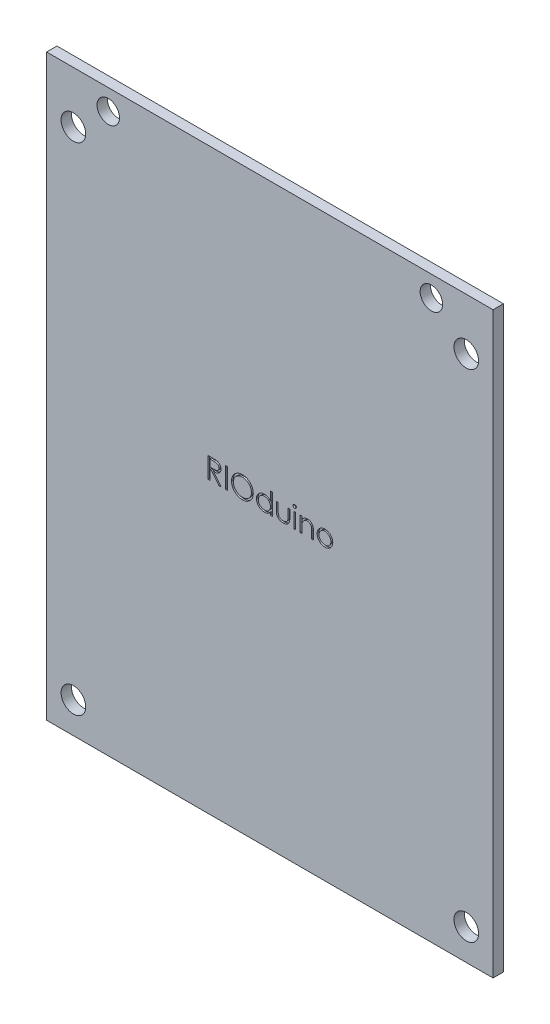
from build123d import *

# Parameters (mm, degrees)
SKETCH1_W           = 68.58
SKETCH1_H           = 88.9
BOSS_EXTRUDE1_DEPTH = 1.5875
SKETCH2_R           = 1.7272
SKETCH2_R_2         = 1.8923
CUT_EXTRUDE1_DEPTH  = 57.161612835
SKETCH3_W           = 0.284935897
SKETCH3_H           = 3.175
SKETCH3_H_2         = 2.320192308
CUT_EXTRUDE2_DEPTH  = 0.254


with BuildPart() as part:
    # Sketch1 → Boss-Extrude1 (new body)
    with BuildSketch(Plane.XY):
        Rectangle(SKETCH1_W, SKETCH1_H)
    extrude(amount=BOSS_EXTRUDE1_DEPTH)

    # Sketch2 → Cut-Extrude1 (cut, through all)
    with BuildSketch(Plane.XY.offset(1.5875)):
        with Locations((-24.8158, 41.275)):
            Circle(SKETCH2_R)
        with Locations((-30.1752, 36.5252)):
            Circle(SKETCH2_R_2)
        with Locations((-30.1752, -39.6748)):
            Circle(SKETCH2_R_2)
        with Locations(Location((30.1752, -39.6748, 0), (0, 0, 180))):
            Circle(SKETCH2_R_2)
        with Locations(Location((24.8158, 41.275, 0), (0, 0, 180))):
            Circle(SKETCH2_R)
        with Locations(Location((30.1752, 36.5252, 0), (0, 0, 180))):
            Circle(SKETCH2_R_2)
    extrude(amount=-CUT_EXTRUDE1_DEPTH, mode=Mode.SUBTRACT)

    # Sketch3 → Cut-Extrude2 (cut)
    # profile 1 of 9: a face of its own
    with BuildSketch(Plane.XY.offset(1.5875)):
        with BuildLine():
            Line((-9.504647436, 3.175), (-8.869265825, 3.175))
            add(Edge.make_bspline(
                [(-8.869265825, 3.175), (-8.826864944, 3.174858861), (-8.745450556, 3.174587859), (-8.628816232, 3.173076774), (-8.522837366, 3.168745752), (-8.427569369, 3.16501868), (-8.343013989, 3.158222418), (-8.268911947, 3.151726689), (-8.205604535, 3.143223439), (-8.167281513, 3.135326377), (-8.149929888, 3.131750801)],
                knots=[0, 0, 0, 0, 1.410062039, 2.707475311, 3.878576406, 4.937260626, 5.877586885, 6.699081471, 7.410979367, 8, 8, 8, 8], degree=3))
            add(Edge.make_bspline(
                [(-8.149929888, 3.131750801), (-8.126701022, 3.126011521), (-8.080738824, 3.114655396), (-8.014562693, 3.090652758), (-7.95150327, 3.062876384), (-7.891822501, 3.030252152), (-7.835819319, 2.992537888), (-7.78291628, 2.950384662), (-7.732873324, 2.904023126), (-7.687714274, 2.852284377), (-7.645133848, 2.798004114), (-7.609221308, 2.739308563), (-7.578263716, 2.677929892), (-7.553616176, 2.613243877), (-7.533769728, 2.545877841), (-7.519775925, 2.475221576), (-7.511383777, 2.401596977), (-7.510529379, 2.351379445), (-7.510096154, 2.325916466)],
                knots=[0, 0, 0, 0, 1.027469482, 2.033020251, 3.019912614, 3.986113645, 4.951240523, 5.91722682, 6.890402269, 7.87763091, 8.8651537, 9.85103654, 10.82876324, 11.815024772, 12.821070561, 13.842952187, 14.906261191, 16, 16, 16, 16], degree=3))
            add(Edge.make_bspline(
                [(-7.510096154, 2.325916466), (-7.511428745, 2.283611764), (-7.514028975, 2.201064333), (-7.538272462, 2.081266248), (-7.57798402, 1.969515941), (-7.63270586, 1.86595412), (-7.702392099, 1.772599463), (-7.786143874, 1.690602407), (-7.884007907, 1.621986201), (-7.975111644, 1.574404013), (-8.055588096, 1.543930446), (-8.121839744, 1.522488892), (-8.194109074, 1.505922681), (-8.271703656, 1.491081704), (-8.354946401, 1.479876953), (-8.443637793, 1.471670399), (-8.537841088, 1.466541369), (-8.602555815, 1.465777551), (-8.635847356, 1.465384615)],
                knots=[0, 0, 0, 0, 1.260483769, 2.459530307, 3.627416485, 4.787058657, 5.939039949, 7.08810263, 8.267026773, 9.491475466, 10.141966685, 10.831826277, 11.566392101, 12.351337768, 13.187381173, 14.07005841, 15.007169909, 16, 16, 16, 16], degree=3))
            Line((-8.635847356, 1.465384615), (-7.469391026, 0))
            Line((-7.469391026, 0), (-7.821744792, 0))
            Line((-7.821744792, 0), (-8.988201122, 1.465384615))
            Line((-8.988201122, 1.465384615), (-9.219711538, 1.465384615))
            Line((-9.219711538, 1.465384615), (-9.219711538, 0))
            Line((-9.219711538, 0), (-9.504647436, 0))
            Line((-9.504647436, 0), (-9.504647436, 3.175))
        make_face()
        with BuildLine():
            Line((-9.219711538, 2.849358974), (-9.219711538, 1.791025641))
            Line((-9.219711538, 1.791025641), (-8.638391426, 1.786573518))
            add(Edge.make_bspline(
                [(-8.638391426, 1.786573518), (-8.611249677, 1.78656151), (-8.558641236, 1.786538236), (-8.482531347, 1.790161162), (-8.411665245, 1.7942826), (-8.346313992, 1.80058665), (-8.286448391, 1.808711086), (-8.232098366, 1.818873793), (-8.183175198, 1.830713879), (-8.126117238, 1.849039639), (-8.06240267, 1.87807367), (-7.993159132, 1.920315229), (-7.934192725, 1.973445788), (-7.884374379, 2.03420028), (-7.84434268, 2.100998877), (-7.816119602, 2.173040869), (-7.798210387, 2.248507533), (-7.796098064, 2.300376245), (-7.795032051, 2.326552484)],
                knots=[0, 0, 0, 0, 1.146690395, 2.22261258, 3.21895312, 4.145990853, 4.996080663, 5.770904154, 6.481378293, 7.121626537, 8.300444488, 9.431385265, 10.535395872, 11.636531494, 12.74115979, 13.810798291, 14.895190096, 16, 16, 16, 16], degree=3))
            add(Edge.make_bspline(
                [(-7.795032051, 2.326552484), (-7.796122547, 2.352085447), (-7.798283511, 2.402682464), (-7.815926323, 2.47675604), (-7.84576169, 2.546666773), (-7.885968291, 2.61213027), (-7.934953239, 2.67155333), (-7.992391541, 2.722396105), (-8.056712682, 2.764350976), (-8.116830126, 2.791161022), (-8.170564019, 2.807598317), (-8.217218068, 2.819165444), (-8.26993348, 2.828458641), (-8.328966217, 2.835904525), (-8.394064268, 2.842304367), (-8.465556787, 2.846614909), (-8.542969438, 2.849167486), (-8.596624154, 2.849293659), (-8.624399038, 2.849358974)],
                knots=[0, 0, 0, 0, 1.101028733, 2.181837193, 3.264309656, 4.369019818, 5.486613113, 6.575447106, 7.666700264, 8.788928104, 9.402425223, 10.0903467, 10.862060571, 11.710948788, 12.657782767, 13.684531032, 14.801375019, 16, 16, 16, 16], degree=3))
            Line((-8.624399038, 2.849358974), (-9.219711538, 2.849358974))
        make_face(mode=Mode.SUBTRACT)
    # profile 2 of 9: a face of its own
    with BuildSketch(Plane.XY.offset(1.5875)):
        with Locations((-6.675641026, 1.5875)):
            Rectangle(SKETCH3_W, SKETCH3_H)
    # profile 3 of 9: a face of its own
    with BuildSketch(Plane.XY.offset(1.5875)):
        with BuildLine():
            add(Edge.make_bspline(
                [(-4.233333333, 3.256410256), (-4.174543123, 3.2549212), (-4.059074299, 3.251996571), (-3.889370642, 3.229609098), (-3.727359377, 3.19087828), (-3.571720751, 3.139295432), (-3.424316408, 3.070484668), (-3.284036841, 2.98731314), (-3.15121582, 2.888909496), (-3.027643567, 2.776034411), (-2.914561905, 2.653222278), (-2.814934137, 2.522160174), (-2.731438627, 2.383640546), (-2.66287152, 2.23807965), (-2.60907921, 2.085806679), (-2.571959792, 1.926009834), (-2.548248756, 1.759724479), (-2.545476729, 1.646307252), (-2.544070513, 1.588772035)],
                knots=[0, 0, 0, 0, 1.065120563, 2.091984664, 3.0946048, 4.079830382, 5.057816894, 6.036188127, 7.030412546, 8.04752943, 9.064399622, 10.05169764, 11.02544977, 11.989514704, 12.962713494, 13.945757189, 14.957906945, 16, 16, 16, 16], degree=3))
            add(Edge.make_bspline(
                [(-2.544070513, 1.588772035), (-2.545476523, 1.531660637), (-2.548247932, 1.419087456), (-2.571986752, 1.253857332), (-2.609216802, 1.095025057), (-2.662371986, 0.942855786), (-2.730612241, 0.797188996), (-2.814663718, 0.658407974), (-2.913670388, 0.526467222), (-3.026343746, 0.402812161), (-3.149171834, 0.289421599), (-3.280916433, 0.190616618), (-3.418614659, 0.105595448), (-3.564038465, 0.037755973), (-3.715259213, -0.016465698), (-3.873630321, -0.053434155), (-4.038409695, -0.077280259), (-4.150778391, -0.080018484), (-4.207892628, -0.081410256)],
                knots=[0, 0, 0, 0, 1.043624062, 2.057103931, 3.04512605, 4.022047818, 4.998200453, 5.980619268, 6.982898556, 8.009068085, 9.034988726, 10.034168286, 11.015286542, 11.987931943, 12.962482838, 13.94673481, 14.956375938, 16, 16, 16, 16], degree=3))
            add(Edge.make_bspline(
                [(-4.207892628, -0.081410256), (-4.265427546, -0.080004741), (-4.378844185, -0.077234097), (-4.545338496, -0.053483822), (-4.705247592, -0.016344211), (-4.858114182, 0.036732206), (-5.004023511, 0.105327837), (-5.143260943, 0.188970381), (-5.275267598, 0.288218287), (-5.398949039, 0.400855109), (-5.512114383, 0.523475017), (-5.610774674, 0.654860377), (-5.694436027, 0.792433541), (-5.762801336, 0.936576295), (-5.816925524, 1.086591818), (-5.853850609, 1.243480794), (-5.87774108, 1.406348774), (-5.880494119, 1.517240546), (-5.881891026, 1.573507612)],
                knots=[0, 0, 0, 0, 1.053102029, 2.075944431, 3.073151272, 4.055350789, 5.033113405, 6.020478099, 7.024410459, 8.052272461, 9.079885166, 10.07527673, 11.055994387, 12.023226415, 12.992069828, 13.970394897, 14.97016774, 16, 16, 16, 16], degree=3))
            add(Edge.make_bspline(
                [(-5.881891026, 1.573507612), (-5.881406035, 1.611274391), (-5.880442172, 1.686331503), (-5.868838279, 1.797789061), (-5.852000165, 1.907454158), (-5.82786843, 2.015014947), (-5.796307417, 2.120208126), (-5.759067364, 2.223759175), (-5.713583361, 2.324618696), (-5.662165916, 2.423264487), (-5.604778419, 2.518158801), (-5.541391132, 2.607856709), (-5.474230476, 2.693110899), (-5.400603684, 2.771712109), (-5.322937337, 2.845946926), (-5.239971522, 2.914674534), (-5.152212487, 2.978514668), (-5.059282613, 3.036045977), (-4.96347175, 3.088078906), (-4.864704959, 3.132730157), (-4.76432364, 3.17105337), (-4.661857638, 3.20211469), (-4.557579052, 3.226636608), (-4.45126029, 3.243334708), (-4.342986054, 3.254968196), (-4.2700415, 3.255927501), (-4.233333333, 3.256410256)],
                knots=[0, 0, 0, 0, 1.037015668, 2.060948919, 3.074880161, 4.083647147, 5.086022904, 6.090072063, 7.104153813, 8.122640571, 9.144368836, 10.147691507, 11.138137339, 12.123020368, 13.103399296, 14.087645067, 15.080126199, 16.082011238, 17.087798457, 18.072939717, 19.057185487, 20.037253025, 21.01195951, 21.997135196, 22.992090687, 24, 24, 24, 24], degree=3))
        make_face()
        with BuildLine():
            add(Edge.make_bspline(
                [(-4.219340946, 2.930769231), (-4.249471363, 2.930401937), (-4.309444149, 2.929670862), (-4.398602264, 2.920040892), (-4.486587804, 2.906315921), (-4.57341894, 2.886738399), (-4.65873236, 2.860064722), (-4.743323287, 2.829366184), (-4.826420343, 2.791972766), (-4.9077492, 2.74972467), (-4.986593589, 2.702962435), (-5.060990826, 2.651280903), (-5.13113351, 2.595892072), (-5.196849902, 2.536666676), (-5.257947037, 2.473303109), (-5.315627444, 2.406761971), (-5.367579136, 2.335141327), (-5.415191052, 2.260383315), (-5.457797593, 2.182585309), (-5.495684736, 2.102566362), (-5.526676373, 2.019673747), (-5.551951529, 1.934806761), (-5.572906357, 1.848099815), (-5.586181417, 1.758895152), (-5.5959172, 1.667641015), (-5.596606488, 1.605971762), (-5.596955128, 1.574779647)],
                knots=[0, 0, 0, 0, 1.008559885, 2.007477868, 2.99961109, 3.989939068, 4.984837346, 5.991145699, 7.001802488, 8.033829008, 9.059044045, 10.069351652, 11.065060232, 12.050310815, 13.029377138, 14.011219647, 14.996725999, 15.989392538, 16.977580475, 17.965360261, 18.951710183, 19.937753436, 20.929683414, 21.935841486, 22.955955122, 24, 24, 24, 24], degree=3))
            add(Edge.make_bspline(
                [(-5.596955128, 1.574779647), (-5.595798646, 1.52891249), (-5.593523489, 1.438677602), (-5.573604836, 1.306445071), (-5.542923473, 1.179364983), (-5.497695719, 1.05813268), (-5.441134805, 0.94170608), (-5.371260411, 0.831118014), (-5.288475384, 0.726338592), (-5.194437756, 0.628099312), (-5.091637872, 0.538432047), (-4.982478896, 0.459725241), (-4.868130266, 0.393131657), (-4.748293789, 0.338879913), (-4.623609236, 0.29589065), (-4.493273172, 0.266427892), (-4.358153826, 0.247037301), (-4.266051018, 0.245175158), (-4.219340946, 0.244230769)],
                knots=[0, 0, 0, 0, 1.032063989, 2.030389145, 3.003944642, 3.970395727, 4.937377036, 5.913328081, 6.909231446, 7.93887556, 8.970685674, 9.976071282, 10.964166581, 11.944589148, 12.933237628, 13.927779006, 14.949070134, 16, 16, 16, 16], degree=3))
            add(Edge.make_bspline(
                [(-4.219340946, 0.244230769), (-4.187945183, 0.24466212), (-4.125677957, 0.245517617), (-4.033062734, 0.254134274), (-3.942116027, 0.267951755), (-3.852965402, 0.287845993), (-3.765712037, 0.31274453), (-3.679991752, 0.342324398), (-3.596717588, 0.379228061), (-3.514839021, 0.420002274), (-3.436465288, 0.466484417), (-3.361648198, 0.516411882), (-3.292273559, 0.57171913), (-3.22660633, 0.630064575), (-3.165258355, 0.692624637), (-3.10864449, 0.759317981), (-3.056955371, 0.830565577), (-3.009361534, 0.905210195), (-2.966904288, 0.983221081), (-2.92991182, 1.063530146), (-2.898528201, 1.145939638), (-2.873193057, 1.230568421), (-2.853339817, 1.317255762), (-2.839660175, 1.406117733), (-2.830091234, 1.496976565), (-2.829369986, 1.558429921), (-2.82900641, 1.589408053)],
                knots=[0, 0, 0, 0, 1.047197238, 2.076906641, 3.100256066, 4.114471768, 5.12198147, 6.126382909, 7.136867548, 8.15857795, 9.17633901, 10.174870724, 11.156907918, 12.133735059, 13.104061851, 14.077631395, 15.04955518, 16.038496417, 17.029181396, 18.010275684, 18.986308667, 19.968651475, 20.955262928, 21.950658345, 22.966943676, 24, 24, 24, 24], degree=3))
            add(Edge.make_bspline(
                [(-2.82900641, 1.589408053), (-2.829370277, 1.62017426), (-2.830092074, 1.6812047), (-2.839655604, 1.771429871), (-2.853354269, 1.859652427), (-2.873096154, 1.94552602), (-2.898541651, 2.029072539), (-2.929917301, 2.110213517), (-2.966915394, 2.189251237), (-3.00937714, 2.265990349), (-3.057107209, 2.339627433), (-3.109262701, 2.410023907), (-3.166744124, 2.475857751), (-3.227909161, 2.538754224), (-3.294285607, 2.597371881), (-3.365572788, 2.651730167), (-3.440905267, 2.703140923), (-3.52066783, 2.749519112), (-3.60298556, 2.792349166), (-3.687453222, 2.829044004), (-3.773113905, 2.860224427), (-3.859749778, 2.886819102), (-3.948090051, 2.906239244), (-4.03753781, 2.92005326), (-4.127969302, 2.92966751), (-4.18878708, 2.930400825), (-4.219340946, 2.930769231)],
                knots=[0, 0, 0, 0, 1.02996197, 2.043119294, 3.035359645, 4.018872909, 4.991431989, 5.957985074, 6.929999688, 7.912076566, 8.892894881, 9.867085534, 10.843653904, 11.817741046, 12.803660682, 13.806313499, 14.818574707, 15.856120519, 16.894564902, 17.924820532, 18.937903209, 19.946497019, 20.957711757, 21.963978472, 22.977135795, 24, 24, 24, 24], degree=3))
        make_face(mode=Mode.SUBTRACT)
    # profile 4 of 9: a face of its own
    with BuildSketch(Plane.XY.offset(1.5875)):
        with BuildLine():
            Line((0.386698718, 3.256410256), (0.386698718, 0))
            Line((0.386698718, 0), (0.101762821, 0))
            Line((0.101762821, 0), (0.101762821, 0.401327123))
            add(Edge.make_bspline(
                [(0.101762821, 0.401327123), (0.069632918, 0.365005492), (0.006931008, 0.294123371), (-0.097790578, 0.201520257), (-0.208795996, 0.124977066), (-0.32554648, 0.063155356), (-0.447936601, 0.016716848), (-0.575695052, -0.016290596), (-0.708873947, -0.037512147), (-0.799817155, -0.039631252), (-0.845903446, -0.040705128)],
                knots=[0, 0, 0, 0, 1.074387032, 2.096679803, 3.090159297, 4.057316773, 5.018401886, 5.985159533, 6.978961417, 8, 8, 8, 8], degree=3))
            add(Edge.make_bspline(
                [(-0.845903446, -0.040705128), (-0.886877232, -0.039592633), (-0.967679354, -0.037398744), (-1.086541445, -0.020378655), (-1.200925129, 0.006954124), (-1.310938491, 0.044964216), (-1.415869651, 0.095383962), (-1.516617025, 0.155746379), (-1.612658681, 0.227629132), (-1.70253072, 0.309805415), (-1.785291178, 0.399063725), (-1.857918189, 0.494264328), (-1.918472769, 0.594995561), (-1.969109556, 0.699982065), (-2.008113383, 0.810032028), (-2.035303751, 0.924764887), (-2.052304014, 1.044044987), (-2.054496996, 1.125270126), (-2.055608974, 1.16645633)],
                knots=[0, 0, 0, 0, 1.033919861, 2.038935746, 3.024066025, 3.998881131, 4.97069526, 5.957263378, 6.95902576, 7.993208707, 9.027059324, 10.027763471, 11.009749337, 11.988697705, 12.965288445, 13.950418724, 14.960734635, 16, 16, 16, 16], degree=3))
            add(Edge.make_bspline(
                [(-2.055608974, 1.16645633), (-2.05447235, 1.206791261), (-2.052225306, 1.286531244), (-2.035485599, 1.403805492), (-2.007336041, 1.516761342), (-1.967831923, 1.625035141), (-1.917175292, 1.728757901), (-1.855554813, 1.82800298), (-1.782966036, 1.923043791), (-1.699279924, 2.011645547), (-1.608624811, 2.093488533), (-1.511643319, 2.164616738), (-1.410747914, 2.226045594), (-1.304373611, 2.274716962), (-1.194094881, 2.314095221), (-1.078929969, 2.341339413), (-0.959358037, 2.357393412), (-0.878177376, 2.359718205), (-0.836999199, 2.360897436)],
                knots=[0, 0, 0, 0, 1.020392517, 2.01726096, 2.990465484, 3.961182959, 4.928053699, 5.906110375, 6.912531644, 7.948652711, 8.985773172, 9.998621852, 10.987621588, 11.969261332, 12.953316658, 13.946091881, 14.958173133, 16, 16, 16, 16], degree=3))
            add(Edge.make_bspline(
                [(-0.836999199, 2.360897436), (-0.789631095, 2.359475856), (-0.69665277, 2.356685452), (-0.560673397, 2.333366105), (-0.432051779, 2.294211209), (-0.310047426, 2.240606975), (-0.195387689, 2.170937722), (-0.087232094, 2.086798909), (0.012538492, 1.985809283), (0.071567931, 1.909961642), (0.101762821, 1.871163862)],
                knots=[0, 0, 0, 0, 1.031072012, 2.023879775, 2.993683497, 3.952812103, 4.918022106, 5.908088563, 6.929940113, 8, 8, 8, 8], degree=3))
            Line((0.101762821, 1.871163862), (0.101762821, 3.256410256))
            Line((0.101762821, 3.256410256), (0.386698718, 3.256410256))
        make_face()
        with BuildLine():
            add(Edge.make_bspline(
                [(-0.833183093, 2.075961538), (-0.874833957, 2.074479596), (-0.957046137, 2.071554476), (-1.077736053, 2.04871852), (-1.193227507, 2.010723209), (-1.302942874, 1.958760342), (-1.405149042, 1.893419988), (-1.496492586, 1.814388447), (-1.577720608, 1.723822013), (-1.646035962, 1.622129384), (-1.701725913, 1.513110687), (-1.740884578, 1.399151376), (-1.766710252, 1.28230686), (-1.769348696, 1.203056424), (-1.770673077, 1.163276242)],
                knots=[0, 0, 0, 0, 1.031046209, 2.035121221, 3.029706178, 4.034933723, 5.034054252, 6.02443088, 7.017295772, 8.038157696, 9.050218397, 10.03989886, 11.016116709, 12, 12, 12, 12], degree=3))
            add(Edge.make_bspline(
                [(-1.770673077, 1.163276242), (-1.768981352, 1.123733788), (-1.765604534, 1.044803872), (-1.741337833, 0.927800063), (-1.700625376, 0.813813896), (-1.645070076, 0.703812852), (-1.575504352, 0.60168299), (-1.494869646, 0.509390164), (-1.402386177, 0.430024609), (-1.299944795, 0.363587667), (-1.190536136, 0.309918809), (-1.075479641, 0.272575693), (-0.95693817, 0.248465849), (-0.87633641, 0.245649645), (-0.835727163, 0.244230769)],
                knots=[0, 0, 0, 0, 0.979072187, 1.954306742, 2.945804271, 3.96968567, 4.997920485, 5.998718438, 6.996577872, 8.005894225, 9.015743152, 10.005417472, 10.995077863, 12, 12, 12, 12], degree=3))
            add(Edge.make_bspline(
                [(-0.835727163, 0.244230769), (-0.794500693, 0.245736594), (-0.712505332, 0.248731529), (-0.591457362, 0.271665248), (-0.473986931, 0.309555515), (-0.361694231, 0.362078295), (-0.257086026, 0.427172467), (-0.163198666, 0.5033789), (-0.08380918, 0.592009646), (-0.016505885, 0.689415428), (0.036267529, 0.796197025), (0.074708668, 0.909893041), (0.09743614, 1.030507434), (0.100300652, 1.112933996), (0.101762821, 1.155008013)],
                knots=[0, 0, 0, 0, 1.01762866, 2.023962475, 3.030623092, 4.058876274, 5.077231937, 6.066672613, 7.034107872, 8.005628644, 8.981990164, 9.965428785, 10.961468474, 12, 12, 12, 12], degree=3))
            add(Edge.make_bspline(
                [(0.101762821, 1.155008013), (0.100892275, 1.187064473), (0.099178766, 1.250161732), (0.086088178, 1.34280598), (0.065264781, 1.431464432), (0.035922184, 1.5162303), (-0.002623482, 1.596634921), (-0.049112526, 1.673255618), (-0.10436247, 1.745693888), (-0.167483916, 1.812952245), (-0.236576635, 1.874299107), (-0.309687397, 1.929058097), (-0.387682403, 1.974042198), (-0.469250001, 2.011272494), (-0.554531712, 2.040899009), (-0.644221488, 2.06066356), (-0.737365998, 2.074234708), (-0.800907777, 2.075379868), (-0.833183093, 2.075961538)],
                knots=[0, 0, 0, 0, 1.050140795, 2.067009409, 3.05949893, 4.030605086, 5.00011959, 5.97591094, 6.962425594, 7.979863591, 8.993523472, 9.986985069, 10.967611495, 11.937549037, 12.921786183, 13.919465291, 14.943216303, 16, 16, 16, 16], degree=3))
        make_face(mode=Mode.SUBTRACT)
    # profile 5 of 9: a face of its own
    with BuildSketch(Plane.XY.offset(1.5875)):
        with BuildLine():
            Line((0.997275641, 2.320192308), (1.282211538, 2.320192308))
            Line((1.282211538, 2.320192308), (1.282211538, 1.244050481))
            add(Edge.make_bspline(
                [(1.282211538, 1.244050481), (1.282340266, 1.212461273), (1.282586517, 1.152032597), (1.284256514, 1.065078249), (1.288184527, 0.985778803), (1.293095639, 0.914088448), (1.299411291, 0.850019315), (1.306925483, 0.793795184), (1.315324194, 0.74477846), (1.32354537, 0.715256987), (1.32736879, 0.701527444)],
                knots=[0, 0, 0, 0, 1.388932606, 2.656963016, 3.823490214, 4.879454478, 5.816252168, 6.653371382, 7.373723809, 8, 8, 8, 8], degree=3))
            add(Edge.make_bspline(
                [(1.32736879, 0.701527444), (1.333502396, 0.684270982), (1.345642091, 0.650116817), (1.367661608, 0.600778219), (1.394901599, 0.555080642), (1.424710157, 0.511261947), (1.459090334, 0.470620145), (1.49760714, 0.433223867), (1.538971255, 0.397660155), (1.600434741, 0.355582523), (1.684489932, 0.310483616), (1.79484636, 0.271570981), (1.914502336, 0.24831563), (1.99720176, 0.245617556), (2.039708534, 0.244230769)],
                knots=[0, 0, 0, 0, 0.725840625, 1.436591201, 2.137033971, 2.831655856, 3.53531722, 4.242432219, 4.957935707, 5.694543706, 7.190802206, 8.724350549, 10.316345118, 12, 12, 12, 12], degree=3))
            add(Edge.make_bspline(
                [(2.039708534, 0.244230769), (2.082211359, 0.245647045), (2.16444646, 0.248387276), (2.282787754, 0.270869486), (2.390965823, 0.308430361), (2.4878949, 0.360869942), (2.573135341, 0.425043099), (2.644168635, 0.500343946), (2.702776644, 0.584390176), (2.728366619, 0.647095772), (2.741235978, 0.678630809)],
                knots=[0, 0, 0, 0, 1.157059328, 2.238695713, 3.266970494, 4.264342957, 5.228770407, 6.160125903, 7.074715775, 8, 8, 8, 8], degree=3))
            add(Edge.make_bspline(
                [(2.741235978, 0.678630809), (2.745040743, 0.691300237), (2.753452151, 0.719309249), (2.762489427, 0.766825163), (2.770630546, 0.823489483), (2.777582142, 0.889673001), (2.782539825, 0.965202761), (2.785212292, 1.050055158), (2.788231513, 1.143963821), (2.788277339, 1.209702431), (2.788301282, 1.244050481)],
                knots=[0, 0, 0, 0, 0.557542046, 1.232589297, 2.036731608, 2.971723315, 4.038036528, 5.22795436, 6.551621927, 8, 8, 8, 8], degree=3))
            Line((2.788301282, 1.244050481), (2.788301282, 2.320192308))
            Line((2.788301282, 2.320192308), (3.073237179, 2.320192308))
            Line((3.073237179, 2.320192308), (3.073237179, 1.190625))
            add(Edge.make_bspline(
                [(3.073237179, 1.190625), (3.072836499, 1.152246352), (3.072059125, 1.077786524), (3.067063177, 0.969578794), (3.058491029, 0.868738758), (3.045480164, 0.775213037), (3.030180588, 0.689073036), (3.010444541, 0.610208352), (2.986878568, 0.538861971), (2.960294279, 0.473781931), (2.928887299, 0.414775105), (2.895479931, 0.3587719), (2.856903888, 0.307161881), (2.816290889, 0.257375942), (2.771113673, 0.211890413), (2.722218801, 0.169661575), (2.67029447, 0.130043896), (2.614188412, 0.094582521), (2.554719698, 0.062635993), (2.491814913, 0.03431855), (2.424703579, 0.011909784), (2.354251566, -0.007422034), (2.280113701, -0.022584446), (2.202361459, -0.033276545), (2.121021029, -0.039830953), (2.065586019, -0.040408843), (2.037164463, -0.040705128)],
                knots=[0, 0, 0, 0, 1.493040784, 2.896703357, 4.213163133, 5.428574705, 6.569057535, 7.615249723, 8.588095153, 9.490268104, 10.346124644, 11.18633936, 12.024365274, 12.850166724, 13.684164916, 14.514361689, 15.362232829, 16.222528818, 17.093394965, 17.986930858, 18.902426812, 19.842810585, 20.827885679, 21.843828298, 22.894529745, 24, 24, 24, 24], degree=3))
            add(Edge.make_bspline(
                [(2.037164463, -0.040705128), (2.008955482, -0.040396965), (1.953522209, -0.039791396), (1.872177581, -0.033312757), (1.794209916, -0.022601059), (1.719896412, -0.007310969), (1.649162495, 0.011774473), (1.581721648, 0.034456252), (1.518363559, 0.062650689), (1.458327027, 0.09438033), (1.402082003, 0.130271687), (1.349369222, 0.169612694), (1.300259363, 0.212344623), (1.254741594, 0.258289011), (1.213454822, 0.308015804), (1.175884556, 0.36112499), (1.141452402, 0.417090342), (1.110289513, 0.477019068), (1.083518135, 0.542852249), (1.059882305, 0.615693187), (1.040550512, 0.69634047), (1.024818415, 0.784725148), (1.012162466, 0.880424221), (1.003375751, 0.983991284), (0.998462819, 1.095174061), (0.997679899, 1.171963605), (0.997275641, 1.211613582)],
                knots=[0, 0, 0, 0, 1.083640291, 2.129454052, 3.13281866, 4.105697902, 5.042300162, 5.946461698, 6.836384745, 7.703652036, 8.553297018, 9.397182691, 10.228592656, 11.052265423, 11.879314572, 12.708807002, 13.549817954, 14.402308542, 15.300838682, 16.27712199, 17.341985831, 18.484375296, 19.725102775, 21.0496083, 22.476576903, 24, 24, 24, 24], degree=3))
            Line((0.997275641, 1.211613582), (0.997275641, 2.320192308))
        make_face()
    # profile 6 of 9: a face of its own
    with BuildSketch(Plane.XY.offset(1.5875)):
        with BuildLine():
            add(Edge.make_bspline(
                [(3.825010016, 3.297115385), (3.842691424, 3.296295189), (3.877315016, 3.294689089), (3.927383195, 3.280935463), (3.972973485, 3.257622177), (4.013411857, 3.226344181), (4.048111782, 3.189560043), (4.072405712, 3.146687593), (4.088019815, 3.100370114), (4.089905361, 3.06806214), (4.090865385, 3.05161258)],
                knots=[0, 0, 0, 0, 1.055194115, 2.066272739, 3.074728998, 4.095836921, 5.109056067, 6.073838105, 7.019297344, 8, 8, 8, 8], degree=3))
            add(Edge.make_bspline(
                [(4.090865385, 3.05161258), (4.089883711, 3.03559003), (4.087943059, 3.003915346), (4.072417773, 2.958400839), (4.047904743, 2.916124096), (4.013434107, 2.879411381), (3.972967589, 2.848150675), (3.927384761, 2.824832805), (3.877314604, 2.811080395), (3.842691285, 2.809474127), (3.825010016, 2.808653846)],
                knots=[0, 0, 0, 0, 0.96129708, 1.900370562, 2.859976407, 3.87933698, 4.906634145, 5.921202961, 6.938410037, 8, 8, 8, 8], degree=3))
            add(Edge.make_bspline(
                [(3.825010016, 2.808653846), (3.807530938, 2.809442807), (3.773510196, 2.810978415), (3.724191703, 2.825102646), (3.678990145, 2.848158655), (3.638472906, 2.879206694), (3.604699802, 2.916349565), (3.58011775, 2.958375039), (3.56462832, 3.003921915), (3.562682836, 3.035592237), (3.561698718, 3.05161258)],
                knots=[0, 0, 0, 0, 1.054934014, 2.053291228, 3.073705704, 4.106921865, 5.123545215, 6.088680038, 7.033164197, 8, 8, 8, 8], degree=3))
            add(Edge.make_bspline(
                [(3.561698718, 3.05161258), (3.562661275, 3.068059851), (3.564551798, 3.100363328), (3.580129361, 3.146713822), (3.604495043, 3.189332756), (3.638495269, 3.226548745), (3.678984193, 3.257614247), (3.724193241, 3.280665637), (3.77350979, 3.294791066), (3.8075308, 3.296326509), (3.825010016, 3.297115385)],
                knots=[0, 0, 0, 0, 0.98631895, 1.937192651, 2.907499808, 3.917963147, 4.944918757, 5.95915025, 6.951458133, 8, 8, 8, 8], degree=3))
        make_face()
    # profile 7 of 9: a face of its own
    with BuildSketch(Plane.XY.offset(1.5875)):
        with Locations((3.826282052, 1.160096154)):
            Rectangle(SKETCH3_W, SKETCH3_H_2)
    # profile 8 of 9: a face of its own
    with BuildSketch(Plane.XY.offset(1.5875)):
        with BuildLine():
            Line((4.660737179, 2.320192308), (4.945673077, 2.320192308))
            Line((4.945673077, 2.320192308), (4.945673077, 1.901692708))
            add(Edge.make_bspline(
                [(4.945673077, 1.901692708), (4.976096503, 1.939650035), (5.035134223, 2.013307553), (5.133454297, 2.11011836), (5.237361978, 2.189897243), (5.346220938, 2.253491399), (5.460178954, 2.301430838), (5.578541385, 2.33605279), (5.702016868, 2.356812599), (5.785986036, 2.359525165), (5.828465545, 2.360897436)],
                knots=[0, 0, 0, 0, 1.12780773, 2.188550248, 3.19190651, 4.159438251, 5.104880172, 6.052711206, 7.014878035, 8, 8, 8, 8], degree=3))
            add(Edge.make_bspline(
                [(5.828465545, 2.360897436), (5.871401192, 2.359314294), (5.955436609, 2.356215704), (6.077790279, 2.331707706), (6.192066143, 2.289847367), (6.29785674, 2.232504989), (6.393222141, 2.161197688), (6.47697397, 2.078123558), (6.546246345, 1.982568682), (6.592689667, 1.893919819), (6.623283647, 1.815280699), (6.642544411, 1.74792829), (6.658901087, 1.67289111), (6.673081315, 1.590395911), (6.682676267, 1.499864696), (6.690243917, 1.401668575), (6.695667447, 1.295839357), (6.695882627, 1.222645059), (6.69599359, 1.184900841)],
                knots=[0, 0, 0, 0, 1.235846778, 2.418850247, 3.575807741, 4.728682307, 5.871620074, 6.994088408, 8.11269785, 9.256955736, 9.865816715, 10.540099792, 11.271859618, 12.076849838, 12.949306005, 13.892391288, 14.913166135, 16, 16, 16, 16], degree=3))
            Line((6.69599359, 1.184900841), (6.69599359, 0))
            Line((6.69599359, 0), (6.411057692, 0))
            Line((6.411057692, 0), (6.411057692, 1.09140625))
            add(Edge.make_bspline(
                [(6.411057692, 1.09140625), (6.410882425, 1.122995182), (6.410547169, 1.183419433), (6.409489761, 1.269932762), (6.406940865, 1.348388443), (6.403359181, 1.418598912), (6.398116774, 1.48049675), (6.392653387, 1.534208022), (6.385972301, 1.579664536), (6.380018802, 1.607028575), (6.377348758, 1.619300881)],
                knots=[0, 0, 0, 0, 1.430800155, 2.736877192, 3.918605307, 4.986035426, 5.920637409, 6.731861385, 7.431261377, 8, 8, 8, 8], degree=3))
            add(Edge.make_bspline(
                [(6.377348758, 1.619300881), (6.367709883, 1.655324599), (6.349158031, 1.72465911), (6.303316489, 1.818706559), (6.245427911, 1.898714915), (6.174763433, 1.964189512), (6.092005629, 2.015144486), (5.997384149, 2.05049943), (5.891812097, 2.072612189), (5.817558478, 2.074813944), (5.77885617, 2.075961538)],
                knots=[0, 0, 0, 0, 1.084156227, 2.086665306, 3.027808233, 3.945421172, 4.874247719, 5.839848303, 6.874090471, 8, 8, 8, 8], degree=3))
            add(Edge.make_bspline(
                [(5.77885617, 2.075961538), (5.755934771, 2.075529734), (5.710573915, 2.074675205), (5.643309298, 2.066101527), (5.578063798, 2.0520785), (5.514182608, 2.033147664), (5.452943396, 2.007146892), (5.392378646, 1.977638106), (5.334768938, 1.940855085), (5.278885857, 1.899860735), (5.226894952, 1.85443174), (5.178518531, 1.80649422), (5.135394756, 1.755444208), (5.096325315, 1.702104256), (5.062599318, 1.645741803), (5.033159731, 1.586900611), (5.008180923, 1.525503233), (4.995768766, 1.482890141), (4.989558293, 1.46156851)],
                knots=[0, 0, 0, 0, 1.023777757, 2.026029729, 3.023749952, 4.003683103, 4.997618607, 5.993177895, 7.010360494, 8.046726602, 9.087585522, 10.09234134, 11.086953743, 12.070360549, 13.043493632, 14.017870808, 15.008233677, 16, 16, 16, 16], degree=3))
            add(Edge.make_bspline(
                [(4.989558293, 1.46156851), (4.985984469, 1.445915575), (4.978204441, 1.411839956), (4.969801414, 1.355919662), (4.962174542, 1.291231327), (4.955791015, 1.21785044), (4.951885387, 1.135520082), (4.947626899, 1.044591857), (4.946076536, 0.944703193), (4.945811329, 0.875160086), (4.945673077, 0.838907252)],
                knots=[0, 0, 0, 0, 0.615963638, 1.340920617, 2.168419149, 3.115676021, 4.16674242, 5.331190069, 6.6087489, 8, 8, 8, 8], degree=3))
            Line((4.945673077, 0.838907252), (4.945673077, 0))
            Line((4.945673077, 0), (4.660737179, 0))
            Line((4.660737179, 0), (4.660737179, 2.320192308))
        make_face()
    # profile 9 of 9: a face of its own
    with BuildSketch(Plane.XY.offset(1.5875)):
        with BuildLine():
            add(Edge.make_bspline(
                [(8.467938702, 2.360897436), (8.511473642, 2.359970435), (8.596835021, 2.358152812), (8.72184646, 2.338726379), (8.841176691, 2.309019841), (8.955282736, 2.267952067), (9.062703233, 2.212904869), (9.165002862, 2.147219298), (9.261901148, 2.069402231), (9.319979182, 2.009205983), (9.349459135, 1.978650841)],
                knots=[0, 0, 0, 0, 1.054011418, 2.066658804, 3.057071809, 4.030435133, 4.997543892, 5.974964718, 6.972108034, 8, 8, 8, 8], degree=3))
            add(Edge.make_bspline(
                [(9.349459135, 1.978650841), (9.374842764, 1.949428154), (9.425118781, 1.89154832), (9.48958554, 1.797699299), (9.545122241, 1.700507922), (9.589629356, 1.598683562), (9.624722198, 1.49311511), (9.649637509, 1.383439714), (9.664457442, 1.269899585), (9.666455848, 1.19278896), (9.667467949, 1.153735978)],
                knots=[0, 0, 0, 0, 1.025258237, 2.030674902, 3.01204498, 3.988269485, 4.97094183, 5.956517959, 6.965070386, 8, 8, 8, 8], degree=3))
            add(Edge.make_bspline(
                [(9.667467949, 1.153735978), (9.666577736, 1.11445664), (9.664818633, 1.036838836), (9.648178352, 0.922521268), (9.622296582, 0.811673108), (9.585256271, 0.704758435), (9.537759986, 0.601450442), (9.479802006, 0.502200351), (9.41097561, 0.406812344), (9.332957699, 0.316096391), (9.246732068, 0.232488468), (9.153190991, 0.159619252), (9.054172689, 0.097188297), (8.948360504, 0.046899549), (8.836720712, 0.007248606), (8.719012515, -0.020600694), (8.595418772, -0.037438793), (8.511029793, -0.039601034), (8.467938702, -0.040705128)],
                knots=[0, 0, 0, 0, 0.998656419, 1.973391657, 2.932242238, 3.890759089, 4.846373663, 5.82037756, 6.809684879, 7.83454468, 8.860553229, 9.859544525, 10.845671541, 11.83227036, 12.833544569, 13.85385346, 14.904124723, 16, 16, 16, 16], degree=3))
            add(Edge.make_bspline(
                [(8.467938702, -0.040705128), (8.424636492, -0.039597329), (8.339826926, -0.037427648), (8.215796929, -0.020666113), (8.097877774, 0.007235772), (7.986091831, 0.047029854), (7.87982472, 0.097189905), (7.780232684, 0.159430509), (7.686615617, 0.232510078), (7.600371746, 0.316090535), (7.522358725, 0.406813853), (7.453531068, 0.502199959), (7.395573415, 0.601450544), (7.348077044, 0.704758408), (7.311036757, 0.811673115), (7.28515498, 0.922521266), (7.268514701, 1.036838836), (7.266755598, 1.11445664), (7.265865385, 1.153735978)],
                knots=[0, 0, 0, 0, 1.099876186, 2.154163076, 3.173186993, 4.173200201, 5.163417411, 6.152872554, 7.150605724, 8.17532212, 9.198891216, 10.186952605, 11.159729845, 12.11414092, 13.071450619, 14.029093627, 15.002601286, 16, 16, 16, 16], degree=3))
            add(Edge.make_bspline(
                [(7.265865385, 1.153735978), (7.266884388, 1.192576701), (7.268901838, 1.269474659), (7.283706872, 1.38280135), (7.308524991, 1.492291124), (7.3436599, 1.597452092), (7.388577252, 1.698830237), (7.443333563, 1.796261763), (7.508457923, 1.88968641), (7.558533979, 1.94749144), (7.583874199, 1.976742788)],
                knots=[0, 0, 0, 0, 1.031353054, 2.041901799, 3.029428768, 4.008703097, 4.981709435, 5.96992636, 6.972712378, 8, 8, 8, 8], degree=3))
            add(Edge.make_bspline(
                [(7.583874199, 1.976742788), (7.613309706, 2.007562912), (7.671199811, 2.068176108), (7.768580443, 2.145766326), (7.870628409, 2.212818764), (7.979236021, 2.266772189), (8.093248328, 2.309261415), (8.213190069, 2.33880299), (8.338625715, 2.358082819), (8.4244048, 2.35994988), (8.467938702, 2.360897436)],
                knots=[0, 0, 0, 0, 1.027980169, 2.021703884, 2.998553061, 3.971491411, 4.943284454, 5.930300938, 6.949603206, 8, 8, 8, 8], degree=3))
        make_face()
        with BuildLine():
            add(Edge.make_bspline(
                [(8.466666667, 2.075961538), (8.435880405, 2.075086516), (8.375102624, 2.07335906), (8.285640572, 2.060220089), (8.19951629, 2.039403425), (8.116566381, 2.009826888), (8.037070575, 1.971637172), (7.96095276, 1.924730303), (7.887989046, 1.869727549), (7.819606746, 1.806714983), (7.756848506, 1.737881895), (7.701986341, 1.664540884), (7.655336423, 1.587881555), (7.616474279, 1.507824192), (7.587529901, 1.423557503), (7.566508659, 1.336035787), (7.553382084, 1.245080731), (7.551670869, 1.18324895), (7.550801282, 1.151827925)],
                knots=[0, 0, 0, 0, 1.021534396, 2.016698045, 2.994645724, 3.958388632, 4.93408049, 5.916473867, 6.921342795, 7.962252576, 8.998418191, 10.008913653, 10.997312074, 11.973003931, 12.956656626, 13.948281152, 14.957379055, 16, 16, 16, 16], degree=3))
            add(Edge.make_bspline(
                [(7.550801282, 1.151827925), (7.552258901, 1.111231443), (7.555152001, 1.030655018), (7.578678965, 0.911990642), (7.618036519, 0.798069962), (7.671183552, 0.689560812), (7.737773479, 0.589165246), (7.816229603, 0.499656113), (7.905709903, 0.422380413), (8.005147728, 0.358262789), (8.112512002, 0.307317867), (8.226137379, 0.271214511), (8.344647152, 0.24774519), (8.425637529, 0.245412495), (8.466666667, 0.244230769)],
                knots=[0, 0, 0, 0, 1.016792936, 2.018143844, 3.017858371, 4.030088057, 5.03801393, 6.028138512, 7.003788237, 7.991172063, 8.984598303, 9.972568034, 10.972917682, 12, 12, 12, 12], degree=3))
            add(Edge.make_bspline(
                [(8.466666667, 0.244230769), (8.507693444, 0.245419381), (8.588679163, 0.247765666), (8.707024274, 0.27109631), (8.820339091, 0.307476059), (8.92759185, 0.358205493), (9.026984412, 0.422623898), (9.117108257, 0.499219754), (9.194894497, 0.589402319), (9.261418553, 0.689693792), (9.315435956, 0.79790174), (9.354609289, 0.912011668), (9.378192813, 1.030649663), (9.381078279, 1.111229649), (9.382532051, 1.151827925)],
                knots=[0, 0, 0, 0, 1.02726834, 2.027799167, 3.010890988, 4.004497153, 4.992059811, 5.971914811, 6.958719428, 7.966827853, 8.981595046, 9.981490638, 10.983022906, 12, 12, 12, 12], degree=3))
            add(Edge.make_bspline(
                [(9.382532051, 1.151827925), (9.381662763, 1.183249138), (9.379952138, 1.245081288), (9.366821277, 1.336033657), (9.345815895, 1.423565319), (9.316813071, 1.507795351), (9.278119787, 1.588088837), (9.230570267, 1.664315804), (9.175932123, 1.738135956), (9.112416592, 1.806492473), (9.04410567, 1.869752114), (8.971112386, 1.924751631), (8.895107441, 1.971431021), (8.815842584, 2.01015354), (8.73288204, 2.039134341), (8.64687843, 2.060340285), (8.557798081, 2.073303535), (8.497238092, 2.075069871), (8.466666667, 2.075961538)],
                knots=[0, 0, 0, 0, 1.042956736, 2.052379634, 3.044323526, 4.02829302, 5.004299113, 5.996692471, 7.007513377, 8.048758398, 9.090003419, 10.095195979, 11.07790575, 12.047570684, 13.018257071, 13.989683339, 14.985167495, 16, 16, 16, 16], degree=3))
        make_face(mode=Mode.SUBTRACT)
    extrude(amount=-CUT_EXTRUDE2_DEPTH, mode=Mode.SUBTRACT)


solid = part.part
